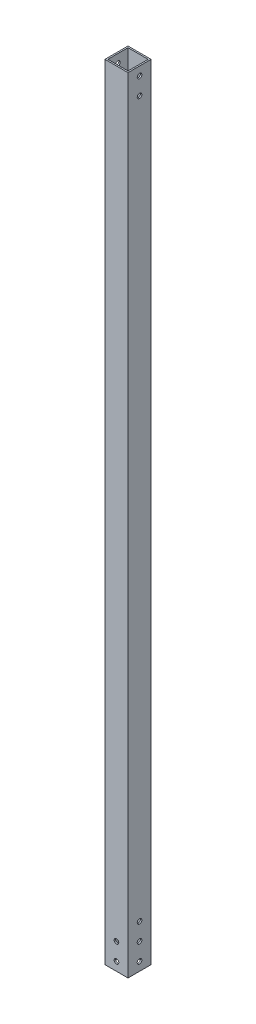
from build123d import *

# Parameters (mm, degrees)
SKETCH1_W           = 25.4
SKETCH1_H           = 25.4
SKETCH1_W_2         = 22.225
SKETCH1_H_2         = 22.225
BOSS_EXTRUDE1_DEPTH = 863.6
SKETCH2_R           = 2.5527
CUT_EXTRUDE1_DEPTH  = 865.066785613
SKETCH3_R           = 2.5527
CUT_EXTRUDE2_DEPTH  = 865.066785613


with BuildPart() as part:
    # Sketch1 → Boss-Extrude1 (new body)
    with BuildSketch(Plane(origin=(0, 0, 0), x_dir=(1, 0, 0), z_dir=(0, 1, 0))):
        Rectangle(SKETCH1_W, SKETCH1_H)
        Rectangle(SKETCH1_W_2, SKETCH1_H_2, mode=Mode.SUBTRACT)
    extrude(amount=BOSS_EXTRUDE1_DEPTH)

    # Sketch2 → Cut-Extrude1 (cut, through all)
    with BuildSketch(Plane.XY.offset(12.7)):
        with Locations((0, 9.525)):
            Circle(SKETCH2_R)
        with Locations((0, 28.575)):
            Circle(SKETCH2_R)
    extrude(amount=-CUT_EXTRUDE1_DEPTH, mode=Mode.SUBTRACT)

    # Sketch3 → Cut-Extrude2 (cut, through all)
    with BuildSketch(Plane(origin=(12.7, 0, 0), x_dir=(0, 0, -1), z_dir=(1, 0, 0))):
        with Locations((0, 9.525)):
            Circle(SKETCH3_R)
        with Locations((0, 28.575)):
            Circle(SKETCH3_R)
        with Locations((0, 47.625)):
            Circle(SKETCH3_R)
        with Locations((0, 854.075)):
            Circle(SKETCH3_R)
        with Locations((0, 835.025)):
            Circle(SKETCH3_R)
    extrude(amount=-CUT_EXTRUDE2_DEPTH, mode=Mode.SUBTRACT)


solid = part.part
